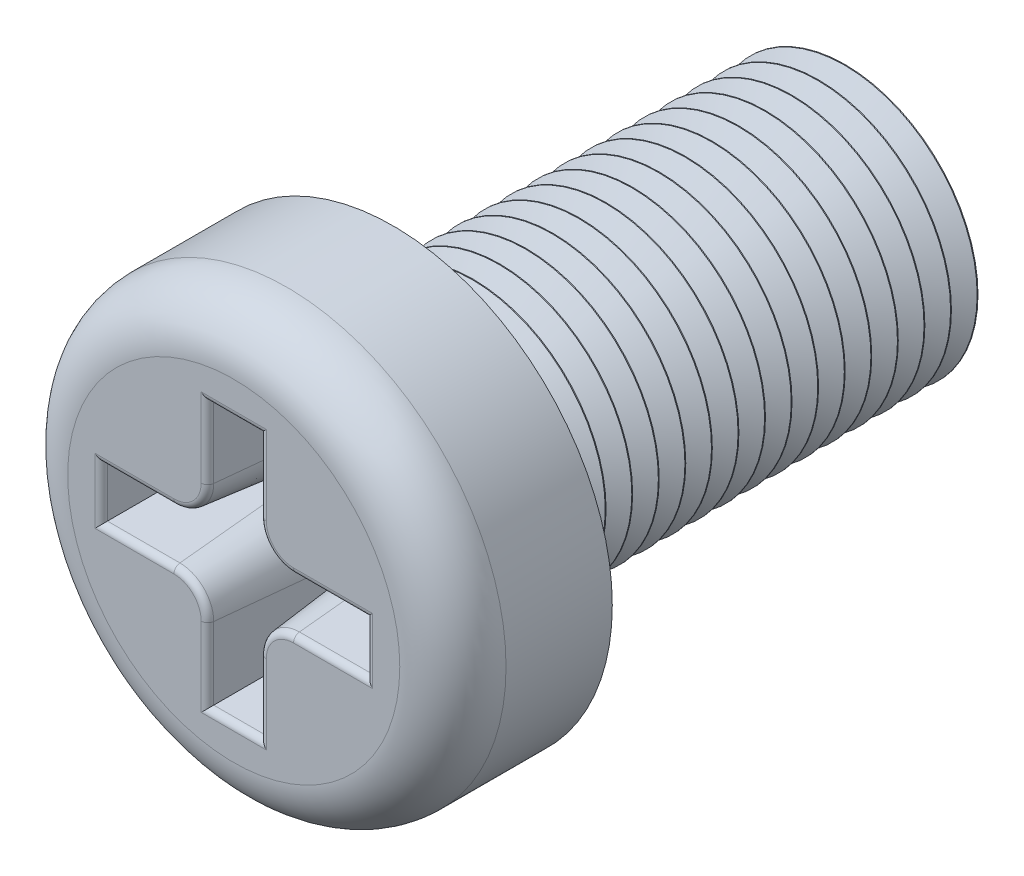
from build123d import *

# Parameters (mm, degrees)
SKETCH1_R           = 3.3
BOSS_EXTRUDE1_DEPTH = 2.4
FILLET1_R           = 0.8
SKETCH2_R           = 2
BOSS_EXTRUDE2_DEPTH = 7
CUT_EXTRUDE1_DEPTH  = 2
CUT_EXTRUDE1_DRAFT  = -6
FILLET2_R           = 0.1
LPATTERN1_COUNT     = 17
LPATTERN1_PITCH     = 0.4


with BuildPart() as part:
    # Sketch1 → Boss-Extrude1 (new body)
    with BuildSketch(Plane.XY):
        Circle(SKETCH1_R)
    extrude(amount=BOSS_EXTRUDE1_DEPTH)

    # Fillet1
    fillet1_edges = [part.edges().sort_by_distance(p)[0] for p in [
        (-3.3, 0, 2.4),
    ]]
    fillet(fillet1_edges, radius=FILLET1_R)

    # Sketch2 → Boss-Extrude2 (add)
    with BuildSketch(Plane(origin=(0, 0, 0), x_dir=(-1, 0, 0), z_dir=(0, 0, -1))):
        with Locations(Location((0, 0, 0), (0, 0, 180))):
            Circle(SKETCH2_R)
    extrude(amount=BOSS_EXTRUDE2_DEPTH)


with BuildPart() as cut_extrude1_tool:
    # Sketch4 → Cut-Extrude1 (with draft: the straight prism first)
    with BuildSketch(Plane.XY.offset(2.4)):
        with BuildLine():
            Line((-0.4, -2), (0.4, -2))
            Line((0.4, -2), (0.4, -0.9))
            ThreePointArc((0.4, -0.9), (0.546446609, -0.546446609), (0.9, -0.4))
            Line((0.9, -0.4), (2, -0.4))
            Line((2, -0.4), (2, 0.4))
            Line((2, 0.4), (0.9, 0.4))
            ThreePointArc((0.9, 0.4), (0.546446609, 0.546446609), (0.4, 0.9))
            Line((0.4, 0.9), (0.4, 2))
            Line((0.4, 2), (-0.4, 2))
            Line((-0.4, 2), (-0.4, 0.9))
            ThreePointArc((-0.4, 0.9), (-0.546446609, 0.546446609), (-0.9, 0.4))
            Line((-0.9, 0.4), (-2, 0.4))
            Line((-2, 0.4), (-2, -0.4))
            Line((-2, -0.4), (-0.9, -0.4))
            ThreePointArc((-0.9, -0.4), (-0.546446609, -0.546446609), (-0.4, -0.9))
            Line((-0.4, -0.9), (-0.4, -2))
        make_face()
    extrude(amount=-CUT_EXTRUDE1_DEPTH)
    # Cut-Extrude1: the draft: its side faces are tilted about the plane it starts from
    cut_extrude1_sides = [cut_extrude1_tool.faces().sort_by_distance(p)[0] for p in [
        (-0.4, -1.45, 1.4),
        (0, -2, 1.4),
        (0.4, -1.45, 1.4),
        (0.546446609, -0.546446609, 1.4),
        (1.45, -0.4, 1.4),
        (2, 0, 1.4),
        (1.45, 0.4, 1.4),
        (0.546446609, 0.546446609, 1.4),
        (0.4, 1.45, 1.4),
        (0, 2, 1.4),
        (-0.4, 1.45, 1.4),
        (-0.546446609, 0.546446609, 1.4),
        (-1.45, 0.4, 1.4),
        (-2, 0, 1.4),
        (-1.45, -0.4, 1.4),
        (-0.546446609, -0.546446609, 1.4),
    ]]
    draft(cut_extrude1_sides, Plane.XY.offset(2.4), CUT_EXTRUDE1_DRAFT)


with BuildPart() as part_1:
    add(part.part)

    # Cut-Extrude1: cut by cut_extrude1_tool
    add(cut_extrude1_tool.part, mode=Mode.SUBTRACT)

    # Fillet2
    fillet2_edges = [part_1.edges().sort_by_distance(p)[0] for p in [
        (0.4, 1.45, 2.4),
        (0, 2, 2.4),
        (-0.4, 1.45, 2.4),
        (-0.546446609, 0.546446609, 2.4),
        (-1.45, 0.4, 2.4),
        (-2, 0, 2.4),
        (-1.45, -0.4, 2.4),
        (-0.546446609, -0.546446609, 2.4),
        (-0.4, -1.45, 2.4),
        (0, -2, 2.4),
        (0.4, -1.45, 2.4),
        (0.546446609, -0.546446609, 2.4),
        (1.45, -0.4, 2.4),
        (2, 0, 2.4),
        (1.45, 0.4, 2.4),
        (0.546446609, 0.546446609, 2.4),
    ]]
    fillet(fillet2_edges, radius=FILLET2_R)

    # Sketch5 → Cut-Revolve1 (revolve, cut)
    with BuildSketch(Plane(origin=(0, 0, 0), x_dir=(0, 0, -1), z_dir=(1, 0, 0)), mode=Mode.PRIVATE) as cut_revolve1_sk:
        Polygon((7, 1.7), (7.2, 2.01), (6.8, 2.01), align=None)
    cut_revolve1 = revolve(cut_revolve1_sk.sketch.rotate(Axis((0, 0, 0), (0, 0, -1)), 90), axis=Axis((0, 0, 0), (0, 0, -1)), mode=Mode.SUBTRACT)

    # LPattern1: Cut-Revolve1 ×17
    with Locations(*[(0, 0, i * LPATTERN1_PITCH) for i in range(1, LPATTERN1_COUNT)]):
        add(cut_revolve1, mode=Mode.SUBTRACT)


solid = part_1.part
